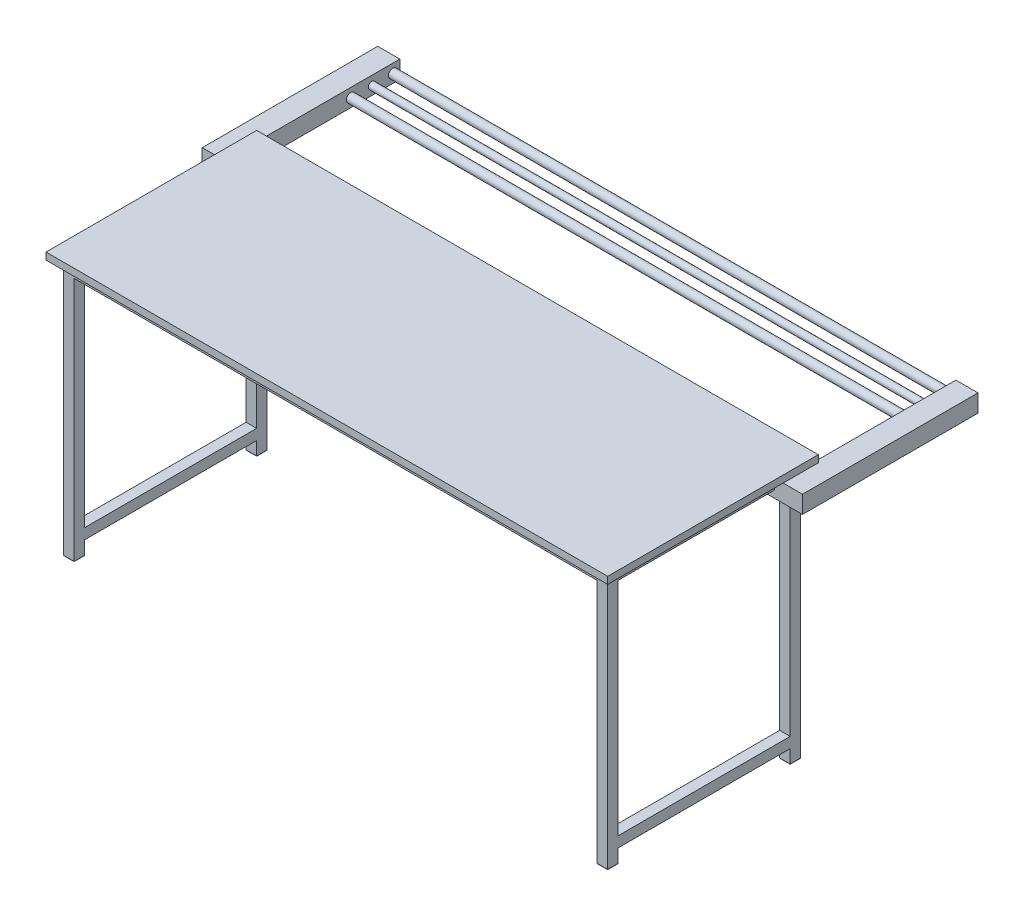
from build123d import *

# Parameters (mm, degrees)
SKETCH1_W             = 1600
SKETCH1_H             = 600
BOSS_EXTRUDE1_DEPTH   = 20
SKETCH2_W             = 1550
SKETCH2_H             = 550
SKETCH2_W_2           = 1490
SKETCH2_H_2           = 490
BOSS_EXTRUDE2_DEPTH   = 30
SKETCH3_W             = 30
SKETCH3_H             = 30
BOSS_EXTRUDE3_DEPTH   = 700
BOSS_EXTRUDE4_START   = -40
SKETCH4_W             = 30
SKETCH4_H             = 550
BOSS_EXTRUDE4_DEPTH   = 30
FILLET1_R             = 2
BOSS_EXTRUDE5_DEPTH   = 50
BOSS_EXTRUDE5_2_DEPTH = 50
SKETCH7_R             = 10
BOSS_EXTRUDE6_DEPTH   = 1584
SKETCH8_R             = 12.5
BOSS_EXTRUDE7_DEPTH   = 1584
SKETCH15_W            = 80
SKETCH15_H            = 45
BOSS_EXTRUDE8_DEPTH   = 20
SKETCH16_W            = 50
SKETCH16_H            = 45
BOSS_EXTRUDE9_DEPTH   = 50


with BuildPart() as part:
    # Sketch1 → Boss-Extrude1 (new body)
    with BuildSketch(Plane(origin=(0, 0, 0), x_dir=(1, 0, 0), z_dir=(0, 1, 0))):
        Rectangle(SKETCH1_W, SKETCH1_H)
    extrude(amount=BOSS_EXTRUDE1_DEPTH)

    # Sketch2 → Boss-Extrude2 (add)
    with BuildSketch(Plane.XZ):
        Rectangle(SKETCH2_W, SKETCH2_H)
        Rectangle(SKETCH2_W_2, SKETCH2_H_2, mode=Mode.SUBTRACT)
    extrude(amount=BOSS_EXTRUDE2_DEPTH)

    # Sketch3 → Boss-Extrude3 (add)
    with BuildSketch(Plane.XZ.offset(30)):
        with Locations((-760, -260)):
            Rectangle(SKETCH3_W, SKETCH3_H)
        with Locations((760, -260)):
            Rectangle(SKETCH3_W, SKETCH3_H)
        with Locations((-760, 260)):
            Rectangle(SKETCH3_W, SKETCH3_H)
        with Locations((760, 260)):
            Rectangle(SKETCH3_W, SKETCH3_H)
    extrude(amount=BOSS_EXTRUDE3_DEPTH)

    # Sketch4 → Boss-Extrude4 (add)
    with BuildSketch(Plane.XZ.offset(730).offset(BOSS_EXTRUDE4_START)):
        with Locations((-760, 0)):
            Rectangle(SKETCH4_W, SKETCH4_H)
        with Locations((760, 0)):
            Rectangle(SKETCH4_W, SKETCH4_H)
    extrude(amount=-BOSS_EXTRUDE4_DEPTH)

    # Fillet1
    fillet1_edges = [part.edges().sort_by_distance(p)[0] for p in [
        (-775, -730, -260),
        (-760, -730, -275),
        (-745, -730, -260),
        (-760, -730, -245),
        (760, -730, -275),
        (775, -730, -260),
        (760, -730, -245),
        (745, -730, -260),
        (-760, -730, 245),
        (-745, -730, 260),
        (-760, -730, 275),
        (-775, -730, 260),
        (760, -730, 245),
        (775, -730, 260),
        (760, -730, 275),
        (745, -730, 260),
    ]]
    fillet(fillet1_edges, radius=FILLET1_R)


with BuildPart() as body_2:
    # Sketch5 → Boss-Extrude5 (new body)
    with BuildSketch(Plane.XZ):
        Polygon((775, -275), (792, -275), (792, -700), (855, -700), (855, -200), (775, -200), align=None)
    extrude(amount=BOSS_EXTRUDE5_DEPTH)



with BuildPart() as body_3:
    # Sketch5 → Boss-Extrude5 2 (new body)
    with BuildSketch(Plane.XZ):
        Polygon((-775, -275), (-775, -200), (-855, -200), (-855, -700), (-792, -700), (-792, -275), align=None)
    extrude(amount=BOSS_EXTRUDE5_2_DEPTH)


with BuildPart() as body_2_1:
    add(body_2.part)

    add(body_3.part)  # Boss-Extrude6 merges body 3
    # Sketch7 → Boss-Extrude6 (add)
    with BuildSketch(Plane.ZY.offset(-792)):
        with Locations(Location((-620, -25, 0), (0, 0, 180))):
            Circle(SKETCH7_R)
    extrude(amount=BOSS_EXTRUDE6_DEPTH)

    # Sketch8 → Boss-Extrude7 (add)
    with BuildSketch(Plane.ZY.offset(-792)):
        with Locations(Location((-680, -25, 0), (0, 0, 180))):
            Circle(SKETCH8_R)
        with Locations(Location((-560, -25, 0), (0, 0, 180))):
            Circle(SKETCH8_R)
    extrude(amount=BOSS_EXTRUDE7_DEPTH)

    # Sketch15 → Boss-Extrude8 (add)
    with BuildSketch(Plane.XZ.offset(50)):
        with Locations((735, -222.5)):
            Rectangle(SKETCH15_W, SKETCH15_H)
        with Locations((-735, -222.5)):
            Rectangle(SKETCH15_W, SKETCH15_H)
    extrude(amount=-BOSS_EXTRUDE8_DEPTH)

    # Sketch16 → Boss-Extrude9 (add)
    with BuildSketch(Plane.XZ):
        with Locations((720, -222.5)):
            Rectangle(SKETCH16_W, SKETCH16_H)
        with Locations((-720, -222.5)):
            Rectangle(SKETCH16_W, SKETCH16_H)
    extrude(amount=BOSS_EXTRUDE9_DEPTH)


solid = Compound([part.part, body_2_1.part])
